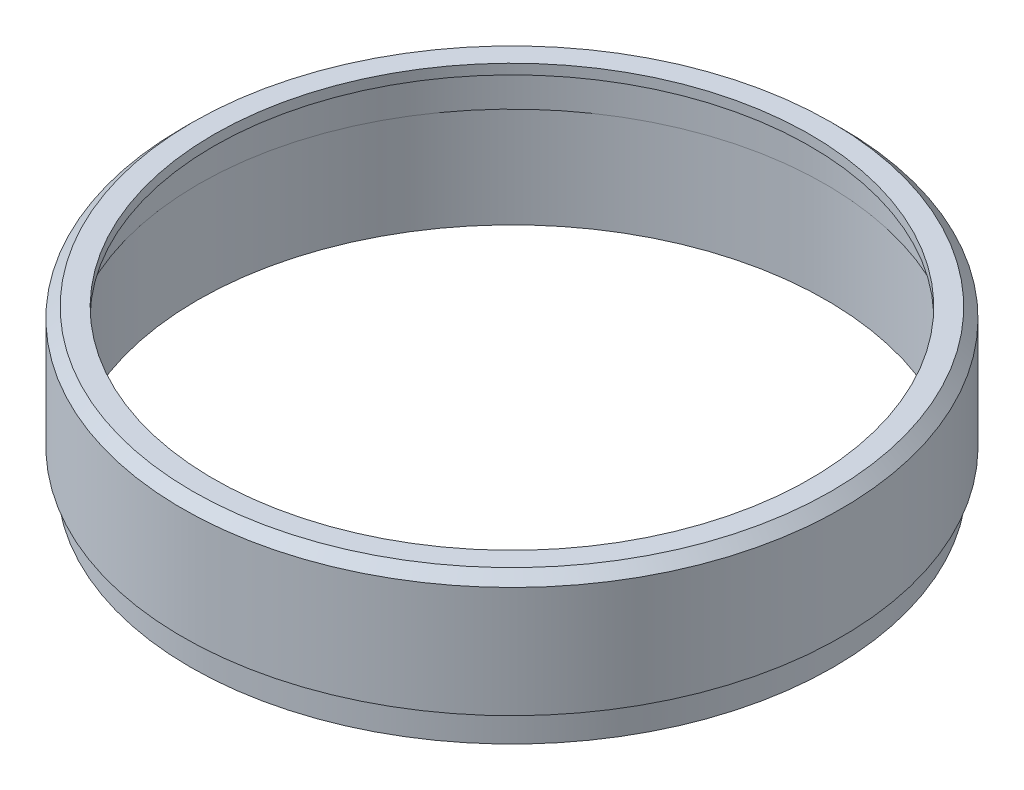
from build123d import *


with BuildPart() as part:
    # Sketch1 → Revolve1 (revolve)
    with BuildSketch(Plane.XY):
        Polygon((-32.65, 4), (-31.85, 4), (-31.85, 1), (-31.15, 1), (-31.15, 11), (-31.05, 11), (-31.05, 15), (-29.55, 15), (-29.55, 16), (-31.65, 16), (-32.65, 15), align=None)
    revolve(axis=Axis((0, 0, 0), (0, -1, 0)))


solid = part.part
